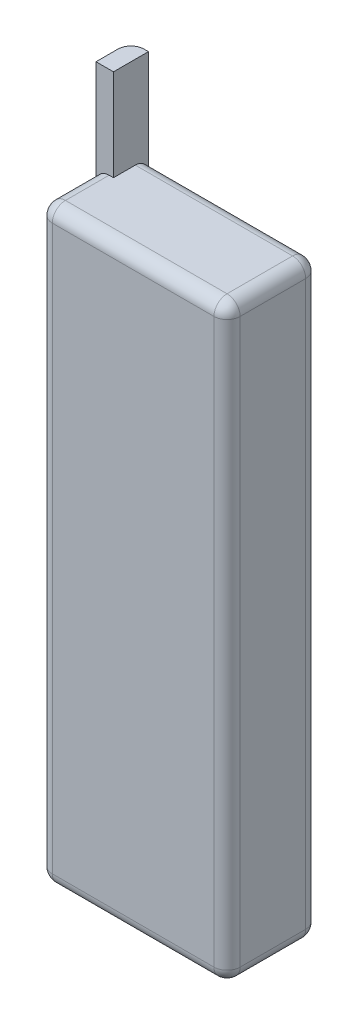
from build123d import *

# Parameters (mm, degrees)
ESBO_O1_W                = 43
ESBO_O1_H                = 135
RESSALTO_EXTRUS_O1_DEPTH = 21
ESBO_O2_W                = 4
ESBO_O2_H                = 8
RESSALTO_EXTRUS_O2_DEPTH = 21
FILETE2_R                = 3
FILETE3_R                = 3


with BuildPart() as part:
    # Esboço1 → Ressalto-extrusão1 (new body)
    with BuildSketch(Plane.XY):
        with Locations((21.5, 67.5)):
            Rectangle(ESBO_O1_W, ESBO_O1_H)
    extrude(amount=RESSALTO_EXTRUS_O1_DEPTH)

    # Esboço2 → Ressalto-extrusão2 (add)
    with BuildSketch(Plane(origin=(0, 135, 0), x_dir=(1, 0, 0), z_dir=(0, 1, 0))):
        with Locations((2, -4)):
            Rectangle(ESBO_O2_W, ESBO_O2_H)
    extrude(amount=RESSALTO_EXTRUS_O2_DEPTH)

    # Filete2
    filete2_edges = [part.edges().sort_by_distance(p)[0] for p in [
        (43, 67.5, 21),
        (0, 67.5, 21),
        (43, 67.5, 0),
        (21.5, 0, 0),
        (0, 78, 0),
        (43, 0, 10.5),
        (0, 0, 10.5),
        (21.5, 0, 21),
    ]]
    fillet(filete2_edges, radius=FILETE2_R)

    # Filete3
    filete3_edges = [part.edges().sort_by_distance(p)[0] for p in [
        (0, 135, 13),
        (21.5, 135, 21),
        (43, 135, 10.5),
        (22, 135, 0),
        (42.121320344, 135, 20.121320344),
        (0.878679656, 135, 20.121320344),
        (42.121320344, 135, 0.878679656),
    ]]
    fillet(filete3_edges, radius=FILETE3_R)


solid = part.part
